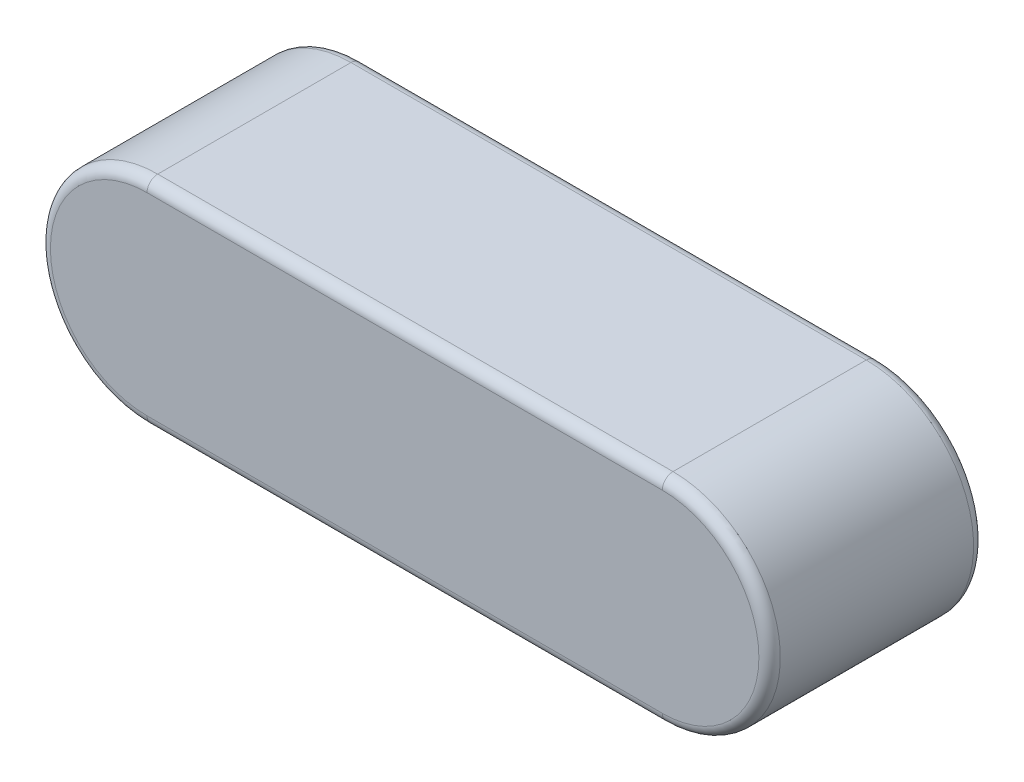
from build123d import *

# Parameters (mm, degrees)
EXTRUDE_582_DEPTH = 5
FILLET_1_R        = 0.25


with BuildPart() as part:
    # 草图1 → Extrude 582 (new body)
    with BuildSketch(Plane.XY):
        with BuildLine():
            Line((-6, 2.5), (6, 2.5))
            ThreePointArc((6, 2.5), (8.5, 0), (6, -2.5))
            Line((6, -2.5), (-6, -2.5))
            ThreePointArc((-6, -2.5), (-8.5, 0), (-6, 2.5))
        make_face()
    extrude(amount=EXTRUDE_582_DEPTH)

    # 圆角1
    fillet_1_edges = [part.edges().sort_by_distance(p)[0] for p in [
        (8.5, 0, 5),
        (0, 2.5, 5),
        (-8.5, 0, 5),
        (0, 2.5, 0),
        (8.5, 0, 0),
        (0, -2.5, 0),
        (-8.5, 0, 0),
        (0, -2.5, 5),
    ]]
    fillet(fillet_1_edges, radius=FILLET_1_R)


solid = part.part
